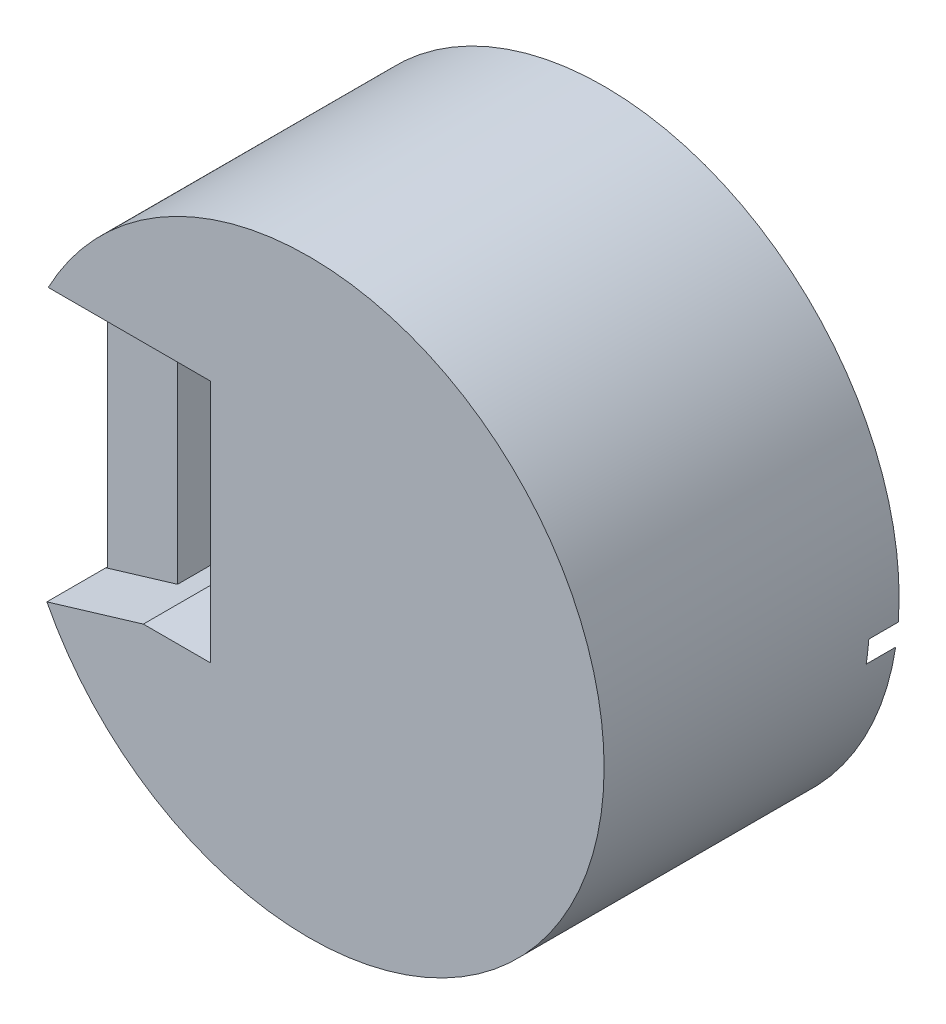
from build123d import *

# Parameters (mm, degrees)
SKETCH_1_R          = 10
EXTRUDE_1_DEPTH     = 10
SKETCH_2_W          = 2.284145506
SKETCH_2_H          = 8.27120278
CUT_EXTRUDE_1_DEPTH = 10
CUT_EXTRUDE_2_DEPTH = 2
CUT_EXTRUDE_3_DEPTH = 2
CUT_EXTRUDE_4_DEPTH = 3.5
CUT_EXTRUDE_5_DEPTH = 8
SKETCH_10_R         = 2
CUT_EXTRUDE_6_DEPTH = 1
CUT_EXTRUDE_7_DEPTH = 1
SKETCH_15_R         = 0.598433569
EXTRUDE_5_DEPTH     = 1


with BuildPart() as part:
    # 草圖1 → 填料-伸長1 (new body)
    with BuildSketch(Plane.XY):
        Circle(SKETCH_1_R)
    extrude(amount=EXTRUDE_1_DEPTH)

    # 草圖2 → 除料-伸長1 (cut)
    with BuildSketch(Plane.XY.offset(10)):
        with Locations((-4.477041196, 0.535617876)):
            Rectangle(SKETCH_2_W, SKETCH_2_H)
    extrude(amount=-CUT_EXTRUDE_1_DEPTH, mode=Mode.SUBTRACT)

    # 草圖3 → 除料-伸長2 (cut)
    with BuildSketch(Plane.XY.offset(10)):
        with BuildLine():
            Line((-5.619113949, 4.671219266), (-8.84192912, 4.671219266))
            ThreePointArc((-8.84192912, 4.671219266), (-10.338729016, 0.052381637), (-8.888807861, -4.581385687))
            Line((-8.888807861, -4.581385687), (-5.619113949, -3.599983514))
            Line((-5.619113949, -3.599983514), (-5.619113949, 4.671219266))
        make_face()
    extrude(amount=-CUT_EXTRUDE_2_DEPTH, mode=Mode.SUBTRACT)

    # 草圖4 → 除料-伸長3 (cut)
    with BuildSketch(Plane(origin=(0, 0, 0), x_dir=(-1, 0, 0), z_dir=(0, 0, -1))):
        with BuildLine():
            Line((5.619113949, 4.671219266), (8.84192912, 4.671219266))
            ThreePointArc((8.84192912, 4.671219266), (10.34374886, 0.021931836), (8.86165829, -4.633682375))
            Line((8.86165829, -4.633682375), (5.619113949, -4.633682375))
            Line((5.619113949, -4.633682375), (5.619113949, 4.671219266))
        make_face()
    extrude(amount=-CUT_EXTRUDE_3_DEPTH, mode=Mode.SUBTRACT)

    # 草圖7 → 除料-伸長4 (cut)
    with BuildSketch(Plane.ZY.offset(12.334968443)):
        Polygon((2, 4.671219266), (8, 4.671219266), (8, -4.581385687), (2, -4.633682375), align=None)
    extrude(amount=-CUT_EXTRUDE_4_DEPTH, mode=Mode.SUBTRACT)

    # 草圖9 → 除料-伸長5 (cut)
    with BuildSketch(Plane.XY.offset(8)):
        Polygon((-5.619113949, 4.614635236), (-5.619113949, -3.599983514), (-6.458251574, -3.851851582), (-6.458251574, 4.614635236), align=None)
    extrude(amount=-CUT_EXTRUDE_5_DEPTH, mode=Mode.SUBTRACT)

    # 草圖10 → 除料-伸長6 (cut)
    with BuildSketch(Plane(origin=(1.147174702, 0, 0), x_dir=(-1, 0, 0), z_dir=(0, 0, -1))):
        with Locations((-4.77940273, 2.844632537)):
            Circle(SKETCH_10_R)
    extrude(amount=-CUT_EXTRUDE_6_DEPTH, mode=Mode.SUBTRACT)

    # 草圖11 → 除料-伸長7 (cut)
    with BuildSketch(Plane(origin=(3.950612042, 2.062182751, 0), x_dir=(-1, 0, 0), z_dir=(0, 0, -1))):
        with BuildLine():
            ThreePointArc((-6.134639705, -3.27946709), (-2.337132754, -6.258197714), (2.486199078, -6.08683493))
            ThreePointArc((2.486199078, -6.08683493), (2.754295623, -5.577783265), (2.245243957, -5.30968672))
            ThreePointArc((2.245243957, -5.30968672), (-2.14989891, -5.730336765), (-5.555178734, -2.919945938))
            ThreePointArc((-5.555178734, -2.919945938), (-6.024669795, -2.809976029), (-6.134639705, -3.27946709))
        make_face()
    extrude(amount=-CUT_EXTRUDE_7_DEPTH, mode=Mode.SUBTRACT)

    # 草圖15 → 填料-伸長5 (add)
    with BuildSketch(Plane(origin=(0.571990358, 0, 1), x_dir=(-1, 0, 0), z_dir=(0, 0, -1))):
        with Locations((-5.926577433, 2.844632537)):
            Circle(SKETCH_15_R)
    extrude(amount=EXTRUDE_5_DEPTH)


solid = part.part
